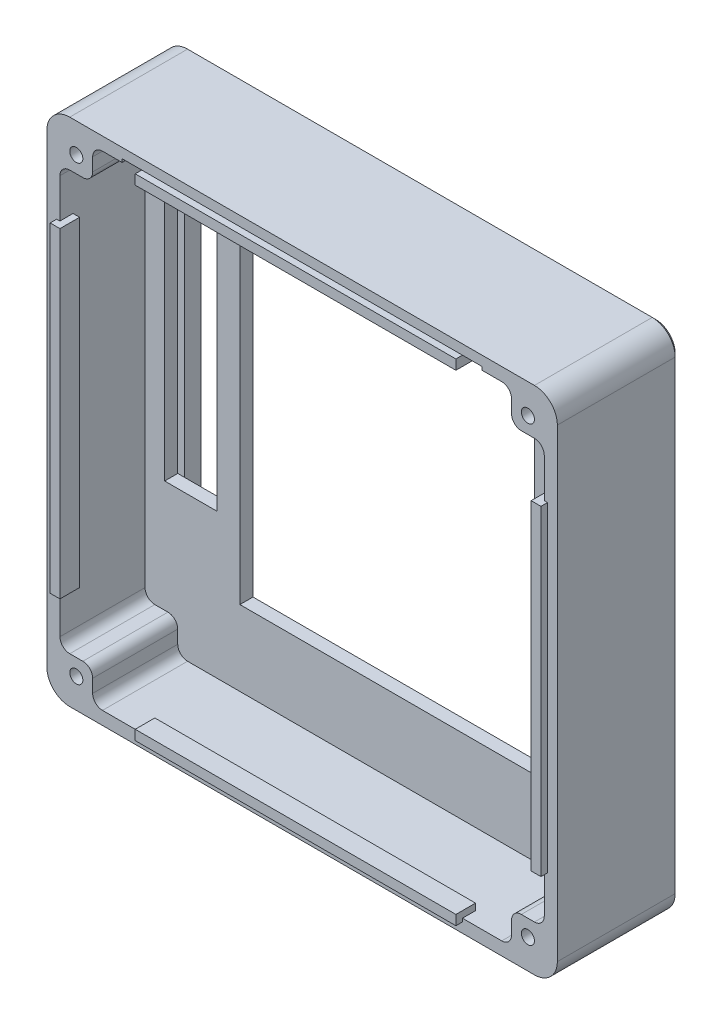
from build123d import *

# Parameters (mm, degrees)
SKETCH_1_W           = 78
SKETCH_1_H           = 78
EXTRUDE_1_DEPTH      = 5.5
SKETCH_2_W           = 78
SKETCH_2_H           = 78
SKETCH_2_W_2         = 74
SKETCH_2_H_2         = 74
SKETCH_2_W_3         = 5
SKETCH_2_H_3         = 5
EXTRUDE_2_DEPTH      = 13
FILLET_1_R           = 1.5
FILLET_2_R           = 3.5
CUT_EXTRUDE_1_DEPTH  = 1
CUT_EXTRUDE_2_DEPTH  = 2.5
SKETCH_5_R           = 1
CUT_EXTRUDE_3_DEPTH  = 58.864064842
CHAMFER_1_SIZE       = 0.5
SKETCH_6_W           = 55
SKETCH_6_H           = 2
SKETCH_6_W_2         = 45
SKETCH_6_H_2         = 55
SKETCH_6_W_3         = 8
SKETCH_6_H_3         = 42
CUT_EXTRUDE_4_DEPTH  = 58.15767665
EXTRUDE_3_DEPTH      = 1
EXTRUDE_3_DEPTH_BACK = 2
SKETCH_7_W           = 49
SKETCH_7_H           = 1.5
SKETCH_7_W_2         = 1.5
SKETCH_7_H_2         = 49


with BuildPart() as part:
    # 草图1 → 凸台-拉伸1 (new body)
    with BuildSketch(Plane.XY):
        Rectangle(SKETCH_1_W, SKETCH_1_H)
    extrude(amount=EXTRUDE_1_DEPTH)

    # 草图2 → 凸台-拉伸2 (add)
    # profile 1 of 5: a face of its own
    with BuildSketch(Plane.XY.offset(5.5)):
        Rectangle(SKETCH_2_W, SKETCH_2_H)
        Rectangle(SKETCH_2_W_2, SKETCH_2_H_2, mode=Mode.SUBTRACT)
    # profile 2 of 5: a face of its own
    with BuildSketch(Plane.XY.offset(5.5)):
        with Locations((-34.5, 34.5)):
            Rectangle(SKETCH_2_W_3, SKETCH_2_H_3)
    # profile 3 of 5: a face of its own
    with BuildSketch(Plane.XY.offset(5.5)):
        with Locations((34.5, 34.5)):
            Rectangle(SKETCH_2_W_3, SKETCH_2_H_3)
    # profile 4 of 5: a face of its own
    with BuildSketch(Plane.XY.offset(5.5)):
        with Locations((34.5, -34.5)):
            Rectangle(SKETCH_2_W_3, SKETCH_2_H_3)
    # profile 5 of 5: a face of its own
    with BuildSketch(Plane.XY.offset(5.5)):
        with Locations((-34.5, -34.5)):
            Rectangle(SKETCH_2_W_3, SKETCH_2_H_3)
    extrude(amount=EXTRUDE_2_DEPTH)

    # 圆角1
    fillet_1_edges = [part.edges().sort_by_distance(p)[0] for p in [
        (-37, -32, 12),
        (-37, 32, 12),
        (-32, 32, 12),
        (-32, 37, 12),
        (32, 37, 12),
        (32, 32, 12),
        (37, 32, 12),
        (37, -32, 12),
        (32, -32, 12),
        (32, -37, 12),
        (-32, -37, 12),
        (-32, -32, 12),
    ]]
    fillet(fillet_1_edges, radius=FILLET_1_R)

    # 圆角2
    fillet_2_edges = [part.edges().sort_by_distance(p)[0] for p in [
        (39, -39, 9.25),
        (-39, -39, 9.25),
        (-39, 39, 9.25),
        (39, 39, 9.25),
    ]]
    fillet(fillet_2_edges, radius=FILLET_2_R)

    # 草图3 → 切除-拉伸1 (cut)
    with BuildSketch(Plane(origin=(0, 0, 0), x_dir=(-1, 0, 0), z_dir=(0, 0, -1))):
        with BuildLine():
            Line((37.5, -35.5), (37.5, 35.5))
            ThreePointArc((37.5, 35.5), (36.914213562, 36.914213562), (35.5, 37.5))
            Line((35.5, 37.5), (-35.5, 37.5))
            ThreePointArc((-35.5, 37.5), (-36.914213562, 36.914213562), (-37.5, 35.5))
            Line((-37.5, 35.5), (-37.5, -35.5))
            ThreePointArc((-37.5, -35.5), (-36.914213562, -36.914213562), (-35.5, -37.5))
            Line((-35.5, -37.5), (35.5, -37.5))
            ThreePointArc((35.5, -37.5), (36.914213562, -36.914213562), (37.5, -35.5))
        make_face()
    extrude(amount=-CUT_EXTRUDE_1_DEPTH, mode=Mode.SUBTRACT)

    # 草图4 → 切除-拉伸2 (cut)
    with BuildSketch(Plane(origin=(0, 0, 1), x_dir=(-1, 0, 0), z_dir=(0, 0, -1))):
        Polygon((27.5, 37.5), (-27.5, 37.5), (-27.5, 36.85), (-32.95, 36.85), (-32.95, -33), (32.95, -33), (32.95, 36.85), (27.5, 36.85), align=None)
    extrude(amount=-CUT_EXTRUDE_2_DEPTH, mode=Mode.SUBTRACT)

    # 草图5 → 切除-拉伸3 (cut, through all)
    with BuildSketch(Plane(origin=(0, 0, 1), x_dir=(-1, 0, 0), z_dir=(0, 0, -1))):
        with Locations((-34.5, 34.5)):
            Circle(SKETCH_5_R)
        with Locations((34.5, 34.5)):
            Circle(SKETCH_5_R)
        with Locations((34.5, -34.5)):
            Circle(SKETCH_5_R)
        with Locations((-34.5, -34.5)):
            Circle(SKETCH_5_R)
    extrude(amount=-CUT_EXTRUDE_3_DEPTH, mode=Mode.SUBTRACT)

    # 倒角1
    chamfer_1_edges = [part.edges().sort_by_distance(p)[0] for p in [
        (-39, 0, 0),
        (39, 0, 0),
        (0, -39, 0),
        (0, 39, 0),
        (-37.974873734, -37.974873734, 0),
        (37.974873734, -37.974873734, 0),
        (37.974873734, 37.974873734, 0),
        (-37.974873734, 37.974873734, 0),
    ]]
    chamfer(chamfer_1_edges, length=CHAMFER_1_SIZE)

    # 草图6 → 切除-拉伸4 (cut, through all)
    with BuildSketch(Plane(origin=(0, 0, 3.5), x_dir=(-1, 0, 0), z_dir=(0, 0, -1))):
        with Locations((0, 36.5)):
            Rectangle(SKETCH_6_W, SKETCH_6_H)
        with Locations((0, 2)):
            Rectangle(SKETCH_6_W_2, SKETCH_6_H_2)
        with Locations((30, 6.1)):
            Rectangle(SKETCH_6_W_3, SKETCH_6_H_3)
    extrude(amount=-CUT_EXTRUDE_4_DEPTH, mode=Mode.SUBTRACT)

    # 草图7 → 凸台-拉伸3 (add, two sides: drawn at the far end of the back side and taken through both)
    with BuildSketch(Plane.XY.offset(18.5).offset(-EXTRUDE_3_DEPTH_BACK)):
        with Locations((0, 36.75)):
            Rectangle(SKETCH_7_W, SKETCH_7_H)
        with Locations((-36.75, 0)):
            Rectangle(SKETCH_7_W_2, SKETCH_7_H_2)
        with Locations((0, -36.75)):
            Rectangle(SKETCH_7_W, SKETCH_7_H)
        with Locations((36.75, 0)):
            Rectangle(SKETCH_7_W_2, SKETCH_7_H_2)
    extrude(amount=EXTRUDE_3_DEPTH + EXTRUDE_3_DEPTH_BACK)


solid = part.part
